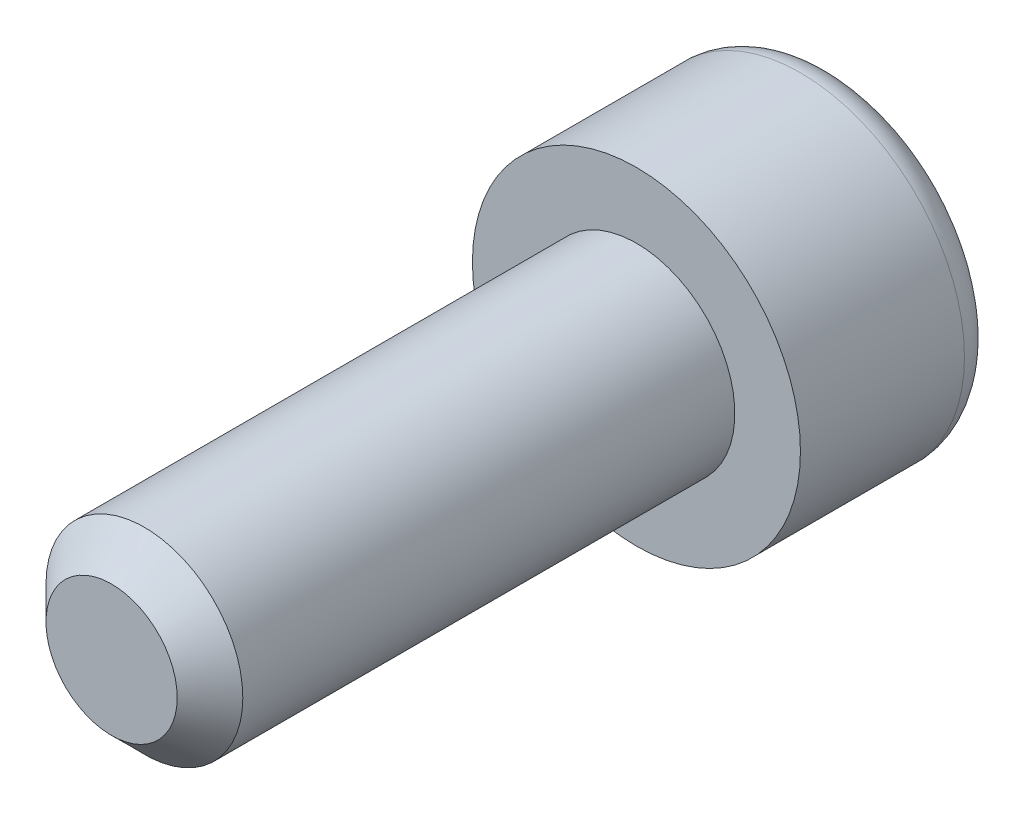
from build123d import *

# Parameters (mm, degrees)
ESQUISSE1_R             = 1.5
BASE_EXTRUSION_DEPTH    = 8
CHANFREIN1_SIZE         = 0.5
ESQUISSE2_R             = 2.5
BOSS_EXTRU_1_DEPTH      = 3
CONG_1_R                = 0.5
ENL_V_MAT_EXTRU_1_DEPTH = 2.5


with BuildPart() as part:
    # Esquisse1 → Base-Extrusion (new body)
    with BuildSketch(Plane.XY):
        Circle(ESQUISSE1_R)
    extrude(amount=BASE_EXTRUSION_DEPTH)

    # Chanfrein1
    chanfrein1_edges = [part.edges().sort_by_distance(p)[0] for p in [
        (-1.5, 0, 8),
    ]]
    chamfer(chanfrein1_edges, length=CHANFREIN1_SIZE)

    # Esquisse2 → Boss.-Extru.1 (add)
    with BuildSketch(Plane(origin=(0, 0, 0), x_dir=(-1, 0, 0), z_dir=(0, 0, -1))):
        Circle(ESQUISSE2_R)
    extrude(amount=BOSS_EXTRU_1_DEPTH)

    # Congé1
    cong_1_edges = [part.edges().sort_by_distance(p)[0] for p in [
        (2.5, 0, -3),
    ]]
    fillet(cong_1_edges, radius=CONG_1_R)

    # Esquisse3 → Enlèv. mat.-Extru.1 (cut)
    with BuildSketch(Plane(origin=(0, 0, -3), x_dir=(-1, 0, 0), z_dir=(0, 0, -1))):
        Polygon((1.732050808, 0), (0.866025404, 1.5), (-0.866025404, 1.5), (-1.732050808, 0), (-0.866025404, -1.5), (0.866025404, -1.5), align=None)
    extrude(amount=-ENL_V_MAT_EXTRU_1_DEPTH, mode=Mode.SUBTRACT)


solid = part.part
